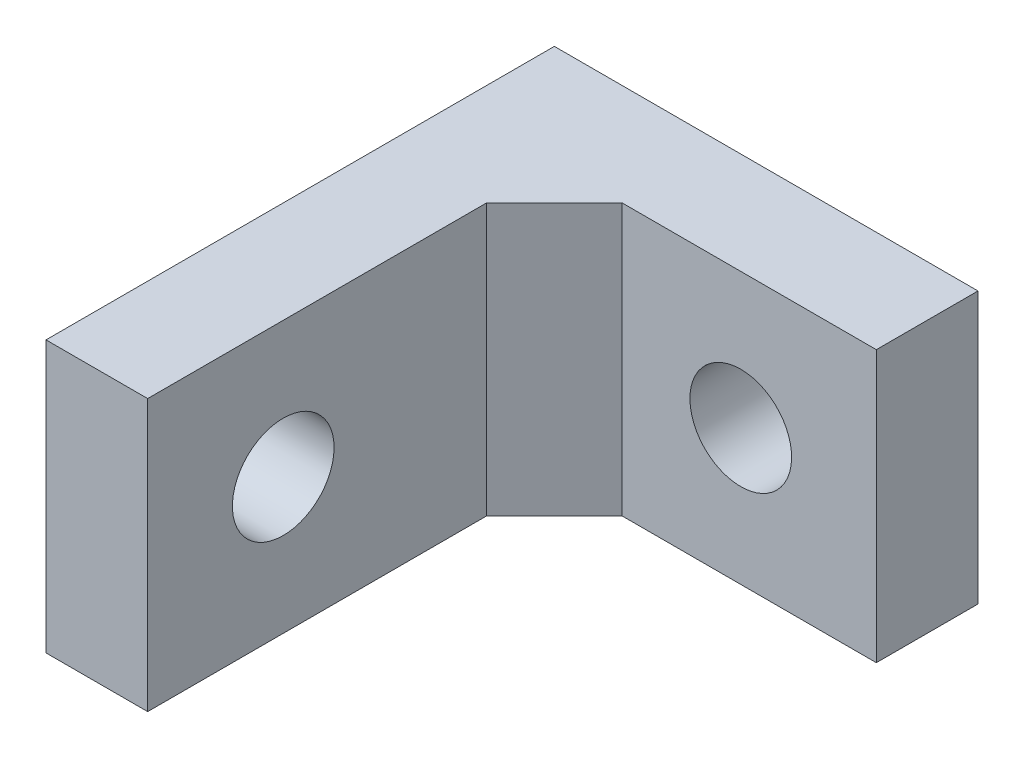
from build123d import *

# Parameters (mm, degrees)
SKETCH1_W           = 15
SKETCH1_H           = 8
SKETCH1_R           = 1.5
BOSS_EXTRUDE1_DEPTH = 3
SKETCH2_W           = 12.5
SKETCH2_H           = 8
SKETCH2_R           = 1.5
BOSS_EXTRUDE2_DEPTH = 3
CHAMFER1_SIZE       = 2


with BuildPart() as part:
    # Sketch1 → Boss-Extrude1 (new body)
    with BuildSketch(Plane(origin=(0, 0, 0), x_dir=(0, 0, -1), z_dir=(1, 0, 0))):
        with Locations((7.5, -4)):
            Rectangle(SKETCH1_W, SKETCH1_H)
        with Locations((4, -4)):
            Circle(SKETCH1_R, mode=Mode.SUBTRACT)
    extrude(amount=BOSS_EXTRUDE1_DEPTH)

    # Sketch2 → Boss-Extrude2 (add)
    with BuildSketch(Plane(origin=(0, 0, -15), x_dir=(-1, 0, 0), z_dir=(0, 0, -1))):
        with Locations((-6.25, -4)):
            Rectangle(SKETCH2_W, SKETCH2_H)
        with Locations(Location((-8.5, -4, 0), (0, 0, 90))):
            Circle(SKETCH2_R, mode=Mode.SUBTRACT)
    extrude(amount=-BOSS_EXTRUDE2_DEPTH)

    # Chamfer1
    chamfer1_edges = [part.edges().sort_by_distance(p)[0] for p in [
        (3, -4, -12),
    ]]
    chamfer(chamfer1_edges, length=CHAMFER1_SIZE)


solid = part.part
